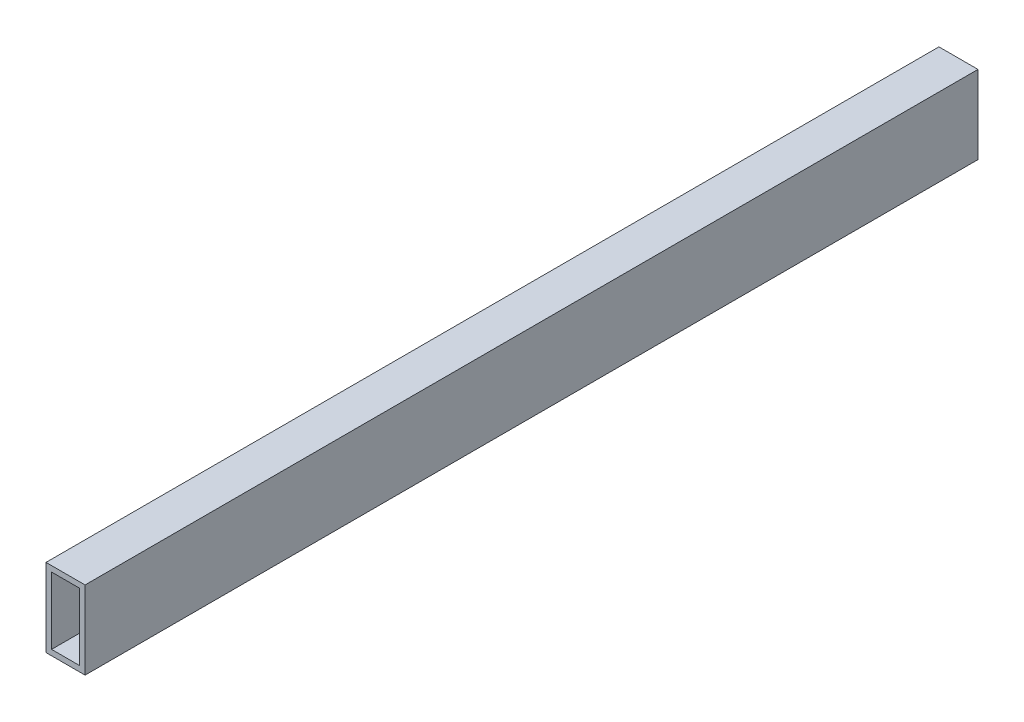
from build123d import *

# Parameters (mm, degrees)
SKETCH1_W           = 7
SKETCH1_H           = 14
SKETCH1_W_2         = 5
SKETCH1_H_2         = 12
BOSS_EXTRUDE1_DEPTH = 160


with BuildPart() as part:
    # Sketch1 → Boss-Extrude1 (new body)
    with BuildSketch(Plane.XY):
        with Locations((-3.5, 7)):
            Rectangle(SKETCH1_W, SKETCH1_H)
        with Locations((-3.5, 7)):
            Rectangle(SKETCH1_W_2, SKETCH1_H_2, mode=Mode.SUBTRACT)
    extrude(amount=BOSS_EXTRUDE1_DEPTH)


solid = part.part
